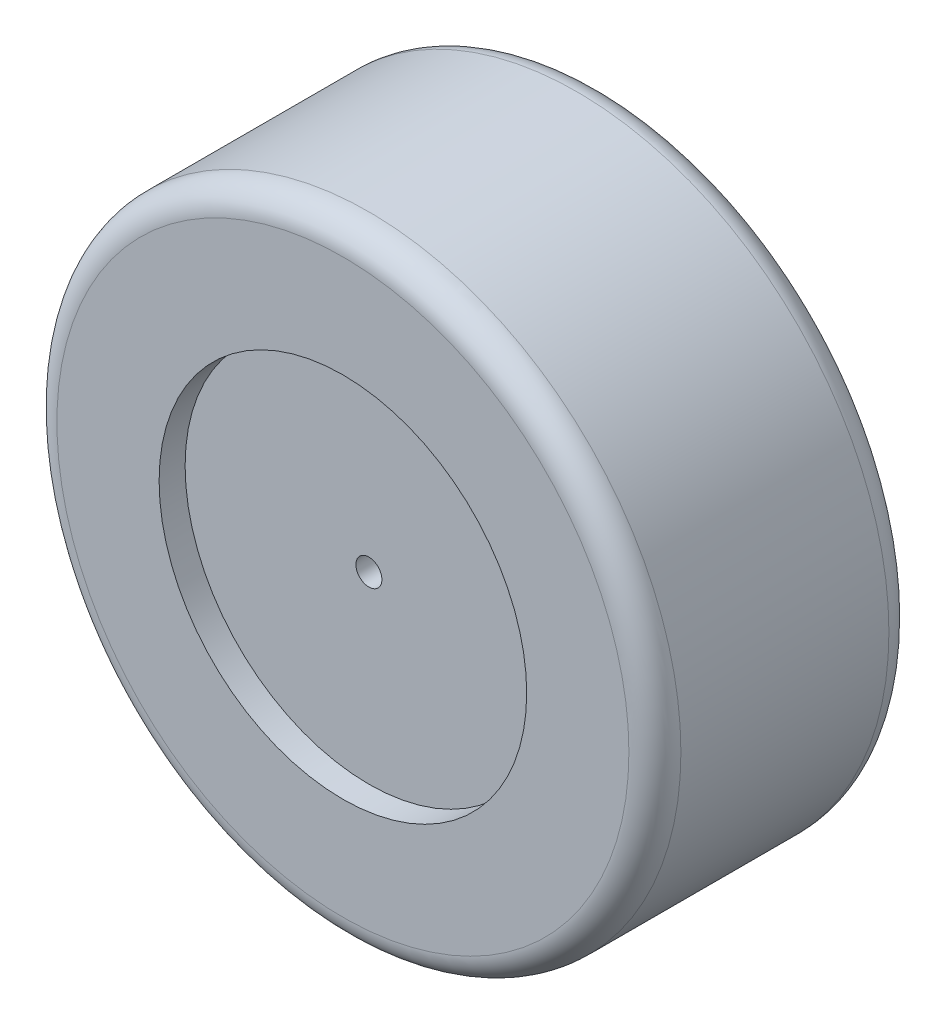
from build123d import *

# Parameters (mm, degrees)
SKETCH1_R           = 60
BOSS_EXTRUDE1_DEPTH = 50
FILLET1_R           = 5
SKETCH2_R           = 35.344502653
CUT_EXTRUDE1_DEPTH  = 5
SKETCH3_R           = 2.5
CUT_EXTRUDE2_DEPTH  = 97.046863624


with BuildPart() as part:
    # Sketch1 → Boss-Extrude1 (new body)
    with BuildSketch(Plane.XY):
        Circle(SKETCH1_R)
    extrude(amount=BOSS_EXTRUDE1_DEPTH)

    # Fillet1
    fillet1_edges = [part.edges().sort_by_distance(p)[0] for p in [
        (-60, 0, 0),
        (-60, 0, 50),
    ]]
    fillet(fillet1_edges, radius=FILLET1_R)

    # Sketch2 → Cut-Extrude1 (cut)
    with BuildSketch(Plane.XY.offset(50)):
        Circle(SKETCH2_R)
    extrude(amount=-CUT_EXTRUDE1_DEPTH, mode=Mode.SUBTRACT)

    # Sketch3 → Cut-Extrude2 (cut, through all)
    with BuildSketch(Plane.XY.offset(45)):
        Circle(SKETCH3_R)
    extrude(amount=-CUT_EXTRUDE2_DEPTH, mode=Mode.SUBTRACT)


solid = part.part
